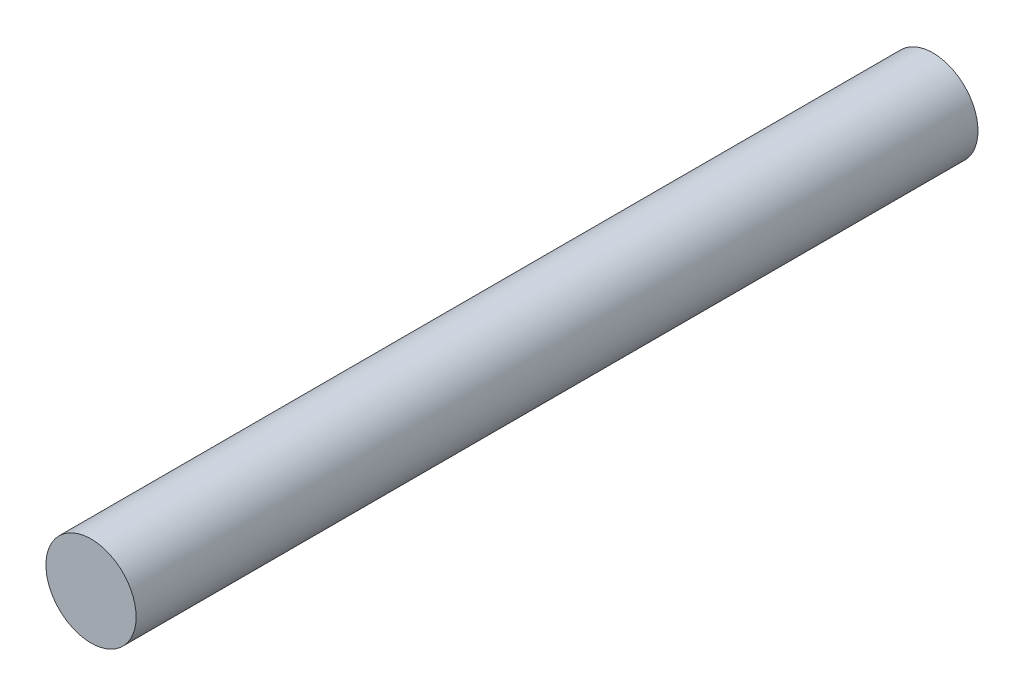
from build123d import *

# Parameters (mm, degrees)
SKETCH1_R           = 3
BOSS_EXTRUDE1_DEPTH = 56


with BuildPart() as part:
    # Sketch1 → Boss-Extrude1 (new body)
    with BuildSketch(Plane.XY):
        Circle(SKETCH1_R)
    extrude(amount=BOSS_EXTRUDE1_DEPTH)


solid = part.part
